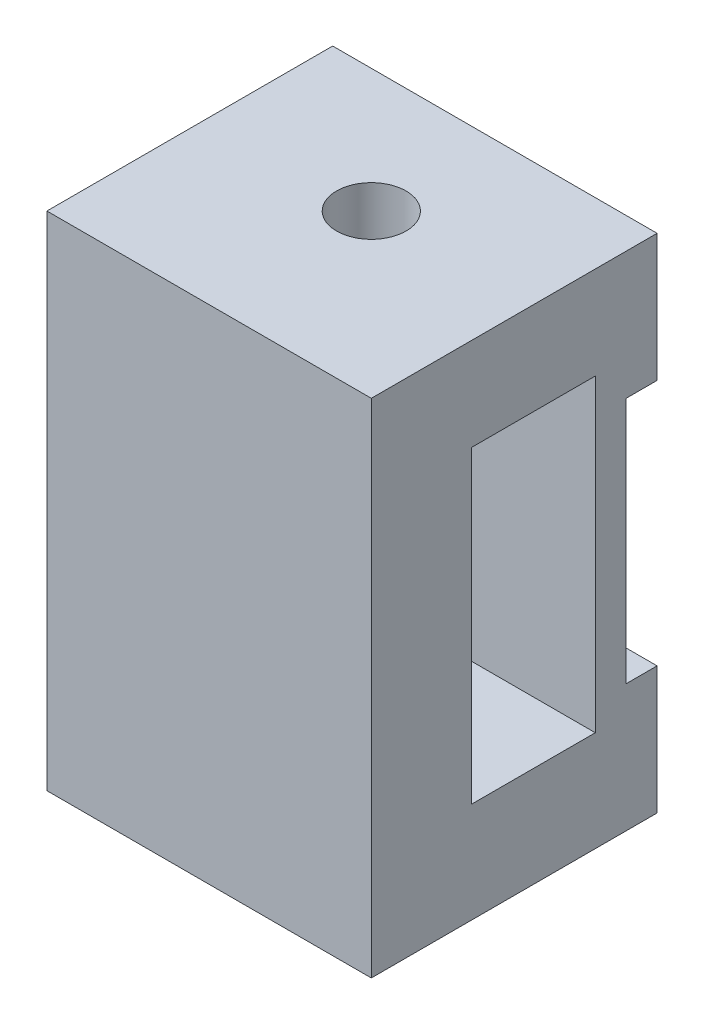
from build123d import *

# Parameters (mm, degrees)
ESQUISSE1_W             = 42
ESQUISSE1_H             = 42
BOSS_EXTRU_6_DEPTH      = 12
ESQUISSE9_W             = 42
ESQUISSE9_H             = 13
BOSS_EXTRU_7_DEPTH      = 40
ESQUISSE10_W            = 42
ESQUISSE10_H            = 42
BOSS_EXTRU_8_DEPTH      = 13
ESQUISSE12_R            = 4.5
ENL_V_MAT_EXTRU_3_DEPTH = 72.463277283
ESQUISSE13_W            = 42
ESQUISSE13_H            = 5
ENL_V_MAT_EXTRU_4_DEPTH = 72.463277283
ESQUISSE15_W            = 4
ESQUISSE15_H            = 32
ENL_V_MAT_EXTRU_5_DEPTH = 71.809603868


with BuildPart() as part:
    # Esquisse1 → Boss.-Extru.6 (new body)
    with BuildSketch(Plane(origin=(0, 0, 0), x_dir=(1, 0, 0), z_dir=(0, 1, 0))):
        Rectangle(ESQUISSE1_W, ESQUISSE1_H)
    extrude(amount=BOSS_EXTRU_6_DEPTH)

    # Esquisse9 → Boss.-Extru.7 (add)
    with BuildSketch(Plane.XZ):
        with Locations((0, -14.5)):
            Rectangle(ESQUISSE9_W, ESQUISSE9_H)
        with Locations((0, 14.5)):
            Rectangle(ESQUISSE9_W, ESQUISSE9_H)
    extrude(amount=BOSS_EXTRU_7_DEPTH)

    # Esquisse10 → Boss.-Extru.8 (add)
    with BuildSketch(Plane.XZ.offset(40)):
        Rectangle(ESQUISSE10_W, ESQUISSE10_H)
    extrude(amount=BOSS_EXTRU_8_DEPTH)

    # Esquisse12 → Enlèv. mat.-Extru.3 (cut, through all)
    with BuildSketch(Plane(origin=(0, 12, 0), x_dir=(1, 0, 0), z_dir=(0, 1, 0))):
        with Locations(Location((0, 0, 0), (0, 0, 270))):
            Circle(ESQUISSE12_R)
    extrude(amount=-ENL_V_MAT_EXTRU_3_DEPTH, mode=Mode.SUBTRACT)

    # Esquisse13 → Enlèv. mat.-Extru.4 (cut, through all)
    with BuildSketch(Plane(origin=(0, 12, 0), x_dir=(1, 0, 0), z_dir=(0, 1, 0))):
        with Locations((0, 18.5)):
            Rectangle(ESQUISSE13_W, ESQUISSE13_H)
    extrude(amount=-ENL_V_MAT_EXTRU_4_DEPTH, mode=Mode.SUBTRACT)

    # Esquisse15 → Enlèv. mat.-Extru.5 (cut, through all)
    with BuildSketch(Plane(origin=(21, 0, 0), x_dir=(0, 0, -1), z_dir=(1, 0, 0))):
        with Locations((14, -20.5)):
            Rectangle(ESQUISSE15_W, ESQUISSE15_H)
    extrude(amount=-ENL_V_MAT_EXTRU_5_DEPTH, mode=Mode.SUBTRACT)


solid = part.part
